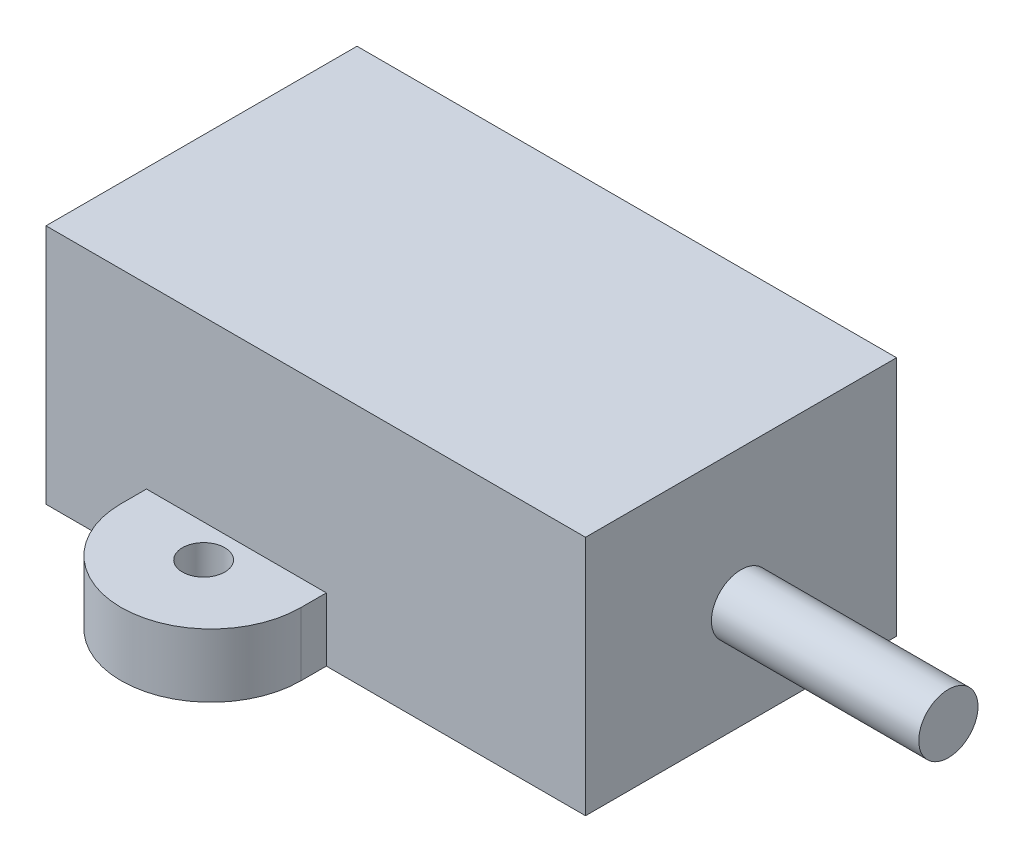
from build123d import *

# Parameters (mm, degrees)
SKETCH_1_W                    = 25.5
SKETCH_1_H                    = 14.7
EXTRUDE_263_DEPTH             = 11.4
SKETCH_2_R                    = 1.4
EXTRUDE_429_DEPTH             = 9.8
SKETCH_3_W                    = 8.5
SKETCH_3_H                    = 5.45
SKETCH_3_R                    = 1
EXTRUDE_694_DEPTH             = 3
FILLET_3_RADIUS               = 4.25
FILLET_3_LENGTH               = 3
FILLET_3_OF_MIRROR_3_2_RADIUS = 4.25
FILLET_3_OF_MIRROR_3_2_LENGTH = 3


with BuildPart() as part:
    # 草图1 → Extrude 263 (new body)
    with BuildSketch(Plane(origin=(0, 0, 0), x_dir=(1, 0, 0), z_dir=(0, 1, 0))):
        Rectangle(SKETCH_1_W, SKETCH_1_H)
    extrude(amount=EXTRUDE_263_DEPTH)

    # 草图2 → Extrude 429 (add)
    with BuildSketch(Plane(origin=(12.75, 0, 0), x_dir=(0, 0, -1), z_dir=(1, 0, 0))):
        with Locations(Location((0, 5, 0), (0, 0, 180))):
            Circle(SKETCH_2_R)
    extrude(amount=EXTRUDE_429_DEPTH)

    # 草图3 → Extrude 694 (add)
    with BuildSketch(Plane.XZ):
        with Locations((-3.75, -10.075)):
            Rectangle(SKETCH_3_W, SKETCH_3_H)
        with Locations(Location((-3.75, -8.9, 0), (0, 0, 270))):
            Circle(SKETCH_3_R, mode=Mode.SUBTRACT)
    extrude_694 = extrude(amount=-EXTRUDE_694_DEPTH)

    # 圆角3: full round fillet: the end face becomes a half cylinder, R = half its width
    fillet_3_face = Plane((-3.75, 1.5, -12.8), x_dir=(0, 1, 0), z_dir=(0, 0, -1))  # on the end face: x along it, z out of the body
    fillet_3_slab = fillet_3_face.offset(-FILLET_3_RADIUS / 2) * Box(FILLET_3_LENGTH, 2 * FILLET_3_RADIUS, FILLET_3_RADIUS, mode=Mode.PRIVATE)  # the body's end, R deep
    fillet_3_round = Plane((-3.75, 1.5, -8.55), x_dir=(0, 0, -1), z_dir=(0, 1, 0)) * Cylinder(FILLET_3_RADIUS, FILLET_3_LENGTH, mode=Mode.PRIVATE)  # its axis R under the face
    add(fillet_3_slab - fillet_3_round, mode=Mode.SUBTRACT)

    # 镜向3: Extrude 694 across plane
    add(extrude_694.mirror(Plane.XY))

    # 圆角3 of Mirror 3 2: full round fillet: the end face becomes a half cylinder, R = half its width
    fillet_3_of_mirror_3_2_face = Plane((-3.75, 1.5, 12.8), x_dir=(0, 1, 0), z_dir=(0, 0, 1))  # on the end face: x along it, z out of the body
    fillet_3_of_mirror_3_2_slab = fillet_3_of_mirror_3_2_face.offset(-FILLET_3_OF_MIRROR_3_2_RADIUS / 2) * Box(FILLET_3_OF_MIRROR_3_2_LENGTH, 2 * FILLET_3_OF_MIRROR_3_2_RADIUS, FILLET_3_OF_MIRROR_3_2_RADIUS, mode=Mode.PRIVATE)  # the body's end, R deep
    fillet_3_of_mirror_3_2_round = Plane((-3.75, 1.5, 8.55), x_dir=(0, 0, 1), z_dir=(0, 1, 0)) * Cylinder(FILLET_3_OF_MIRROR_3_2_RADIUS, FILLET_3_OF_MIRROR_3_2_LENGTH, mode=Mode.PRIVATE)  # its axis R under the face
    add(fillet_3_of_mirror_3_2_slab - fillet_3_of_mirror_3_2_round, mode=Mode.SUBTRACT)


solid = part.part
